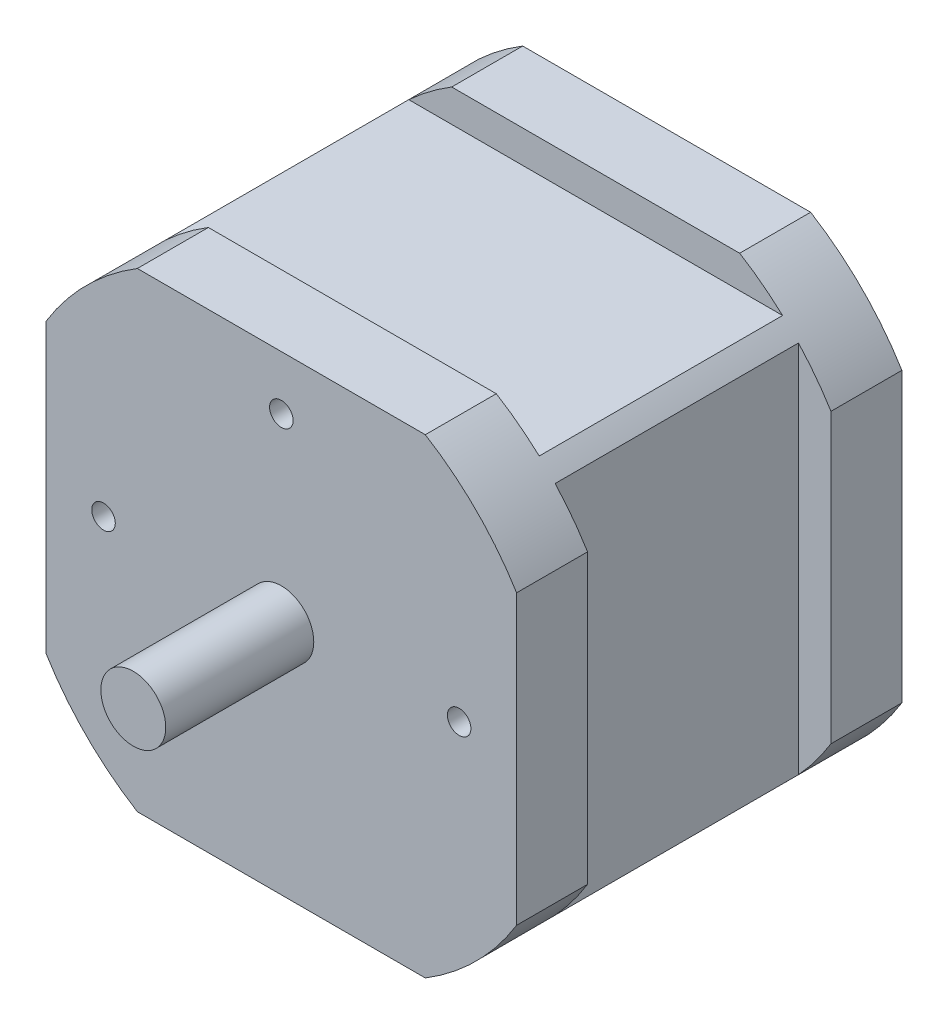
from build123d import *

# Parameters (mm, degrees)
SKETCH_1_W               = 50
SKETCH_1_H               = 50
EXTRUDE_1_DEPTH          = 30
SKETCH_2_W               = 58
SKETCH_2_H               = 58
EXTRUDE_2_DEPTH          = 8.75
SKETCH_3_W               = 58
SKETCH_3_H               = 58
EXTRUDE_3_DEPTH          = 8.75
SKETCH_6_R               = 4
EXTRUDE_4_DEPTH          = 18.25
SKETCH_4_OUTSIDE_W       = 81.024
SKETCH_4_OUTSIDE_H       = 81.024
SKETCH_4_OUTSIDE_R       = 34
CUT_EXTRUDE_2_DEPTH      = 63.755477849
HOLE_WIZARD_M3_5_1_D     = 2.9
HOLE_WIZARD_M3_5_1_DEPTH = 8
HOLE_WIZARD_M3_5_1_TIP   = 0.871247898


with BuildPart() as part:
    # 草图1 → 凸台-拉伸1 (new body)
    with BuildSketch(Plane.XY):
        Rectangle(SKETCH_1_W, SKETCH_1_H)
    extrude(amount=EXTRUDE_1_DEPTH)

    # 草图2 → 凸台-拉伸2 (add)
    with BuildSketch(Plane.XY.offset(30)):
        Rectangle(SKETCH_2_W, SKETCH_2_H)
    extrude(amount=EXTRUDE_2_DEPTH)

    # 草图3 → 凸台-拉伸3 (add)
    with BuildSketch(Plane(origin=(0, 0, 0), x_dir=(-1, 0, 0), z_dir=(0, 0, -1))):
        Rectangle(SKETCH_3_W, SKETCH_3_H)
    extrude(amount=EXTRUDE_3_DEPTH)

    # 草图6 → 凸台-拉伸4 (add)
    with BuildSketch(Plane.XY.offset(38.75)):
        Circle(SKETCH_6_R)
    extrude(amount=EXTRUDE_4_DEPTH)

    # 草图4 outside → 切除-拉伸2 (cut, through all)
    with BuildSketch(Plane.XY.offset(38.75)):
        Rectangle(SKETCH_4_OUTSIDE_W, SKETCH_4_OUTSIDE_H)
        Circle(SKETCH_4_OUTSIDE_R, mode=Mode.SUBTRACT)
    extrude(amount=-CUT_EXTRUDE_2_DEPTH, mode=Mode.SUBTRACT)

    # M3.5 螺纹孔1
    with Locations(Plane.XY.offset(38.75)):
        with Locations((0, 22.35), (-21.92, 0.43), (21.92, 0.43)):
            Hole(HOLE_WIZARD_M3_5_1_D / 2, depth=HOLE_WIZARD_M3_5_1_DEPTH)
            with Locations((0, 0, -(HOLE_WIZARD_M3_5_1_DEPTH + HOLE_WIZARD_M3_5_1_TIP / 2))):  # 118° drill point
                Cone(0, HOLE_WIZARD_M3_5_1_D / 2, HOLE_WIZARD_M3_5_1_TIP, mode=Mode.SUBTRACT)


solid = part.part
